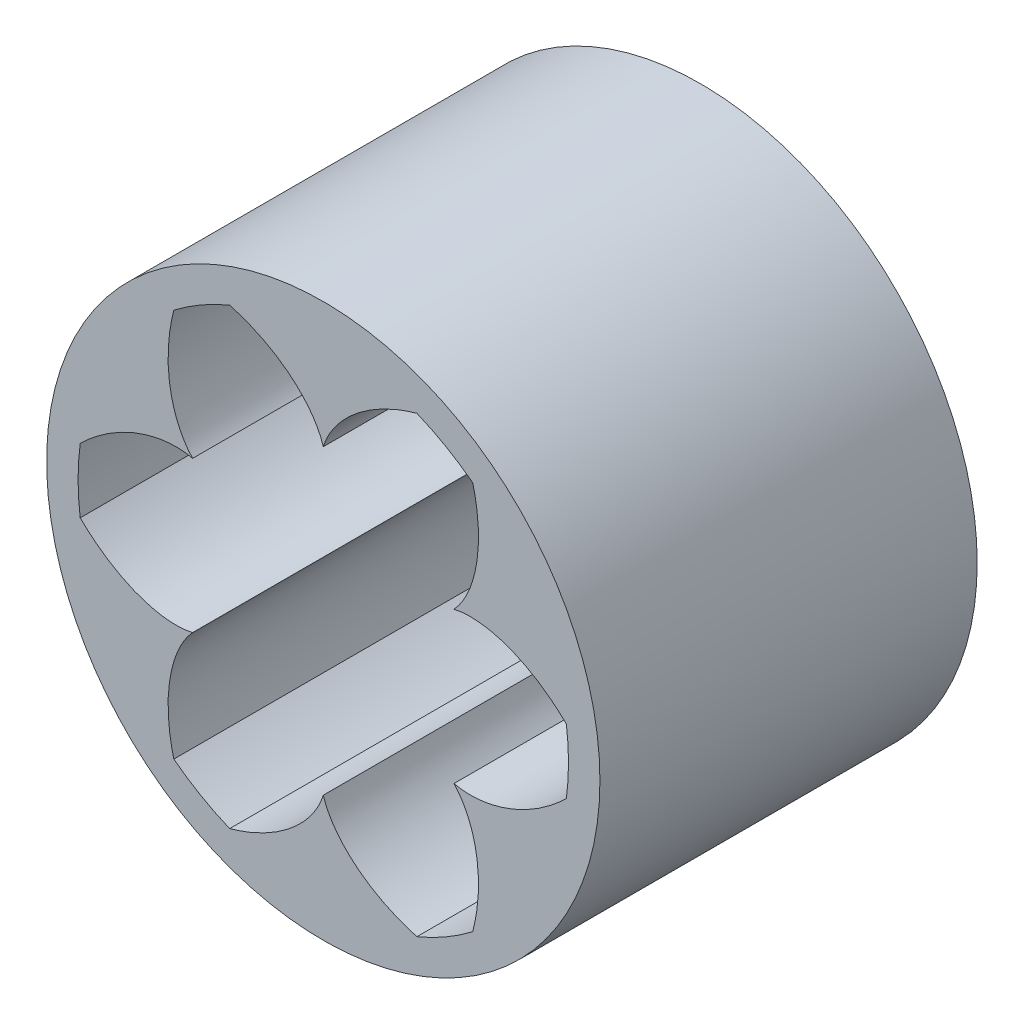
from build123d import *

# Parameters (mm, degrees)
SKETCH_1_R               = 2.2
SKETCH_1_R_2             = 1.05
EXTRUDE_1_DEPTH          = 3
CUT_EXTRUDE_2_DEPTH      = 5.322036557
PATTERN_CIRCULAR_1_COUNT = 6


with BuildPart() as part:
    # 草图1 → 凸台-拉伸1 (new body)
    with BuildSketch(Plane.XY):
        Circle(SKETCH_1_R)
        Circle(SKETCH_1_R_2, mode=Mode.SUBTRACT)
    extrude(amount=EXTRUDE_1_DEPTH)

    # 草图1<3> → 切除-拉伸2 (cut, through all)
    with BuildSketch(Plane.XY):
        with BuildLine():
            Line((0.97057531, 0.574051885), (0.903756587, 0.534531599))
            ThreePointArc((0.903756587, 0.534531599), (1.012779447, 0.277088058), (1.05, 0))
            ThreePointArc((1.05, 0), (1.012779447, -0.277088058), (0.903756587, -0.534531599))
            Line((0.903756587, -0.534531599), (0.97057531, -0.574051885))
            add(Edge.make_bspline(
                [(0.97057531, -0.574051885), (0.977973742, -0.578427727), (0.999529885, -0.589101664), (1.043549257, -0.602890479), (1.117277172, -0.615236154), (1.21432505, -0.616206808), (1.33781215, -0.599805412), (1.478114557, -0.559025913), (1.624165195, -0.492647236), (1.761345474, -0.4056243), (1.854017664, -0.330826946), (1.909685478, -0.279355742), (1.933057183, -0.256495473)],
                knots=[0, 0, 0, 0, 0, 0.005604068, 0.015718248, 0.029959916, 0.048733667, 0.068727063, 0.096888892, 0.125050566, 0.153212235, 0.174576438, 0.174576438, 0.174576438, 0.174576438, 0.174576438], degree=4))
            ThreePointArc((1.933057183, -0.256495473), (1.945759685, -0.128527221), (1.95, 0))
            ThreePointArc((1.95, 0), (1.945759685, 0.128527221), (1.933057183, 0.256495473))
            add(Edge.make_bspline(
                [(0.97057531, 0.574051885), (0.977973742, 0.578427727), (0.999529885, 0.589101664), (1.043549257, 0.602890479), (1.117277172, 0.615236154), (1.21432505, 0.616206808), (1.33781215, 0.599805412), (1.478114557, 0.559025913), (1.624165195, 0.492647236), (1.761345474, 0.4056243), (1.854017664, 0.330826946), (1.909685478, 0.279355742), (1.933057183, 0.256495473)],
                knots=[0, 0, 0, 0, 0, 0.005604068, 0.015718248, 0.029959916, 0.048733667, 0.068727063, 0.096888892, 0.125050566, 0.153212235, 0.174576438, 0.174576438, 0.174576438, 0.174576438, 0.174576438], degree=4))
        make_face()
    cut_extrude_2 = extrude(amount=CUT_EXTRUDE_2_DEPTH, mode=Mode.SUBTRACT)

    # 阵列(圆周)1: 切除-拉伸2 ×6 about axis
    pattern_circular_1_axis = Axis((0, 0, 3), (0, 0, 1))
    for i in range(1, PATTERN_CIRCULAR_1_COUNT):
        add(cut_extrude_2.rotate(pattern_circular_1_axis, i * 360 / PATTERN_CIRCULAR_1_COUNT), mode=Mode.SUBTRACT)


solid = part.part
